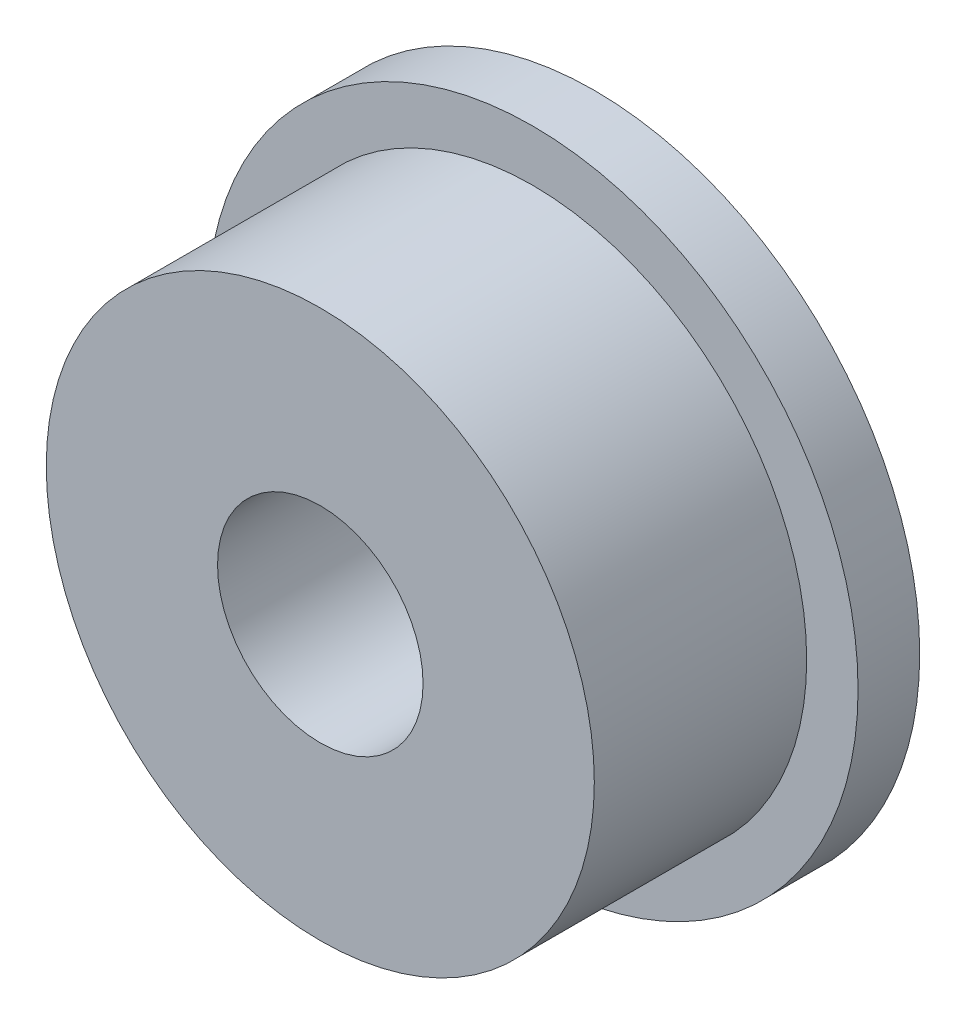
from build123d import *

# Parameters (mm, degrees)
F693ZZ_EXTERNAL_ENVELOPE_3X8X4_START = 2.5
SKETCH1_R                            = 4
SKETCH1_R_2                          = 1.5
F693ZZ_EXTERNAL_ENVELOPE_3X8X4_DEPTH = 4
FLANGE_9P5X0P9_START                 = 2.5
SKETCH2_R                            = 4.75
SKETCH2_R_2                          = 1.5
FLANGE_9P5X0P9_DEPTH                 = 0.9


with BuildPart() as part:
    # Sketch1 → F693ZZ_External_Envelope_3x8x4 (new body)
    with BuildSketch(Plane.XY.offset(F693ZZ_EXTERNAL_ENVELOPE_3X8X4_START)):
        Circle(SKETCH1_R)
        Circle(SKETCH1_R_2, mode=Mode.SUBTRACT)
    extrude(amount=F693ZZ_EXTERNAL_ENVELOPE_3X8X4_DEPTH)

    # Sketch2 → Flange_9p5x0p9 (add)
    with BuildSketch(Plane.XY.offset(FLANGE_9P5X0P9_START)):
        Circle(SKETCH2_R)
        Circle(SKETCH2_R_2, mode=Mode.SUBTRACT)
    extrude(amount=FLANGE_9P5X0P9_DEPTH)


solid = part.part
